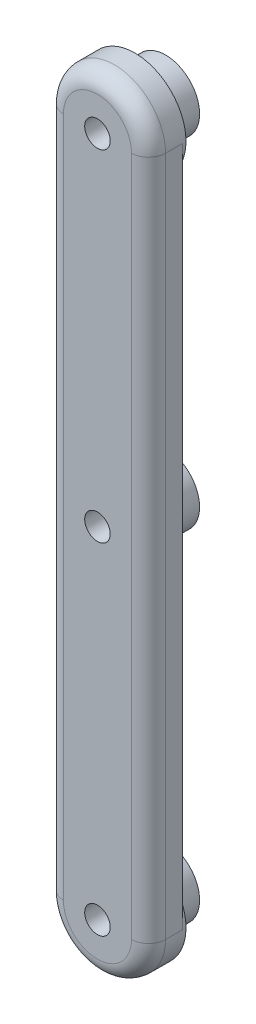
from build123d import *

# Parameters (mm, degrees)
EXTRUDE_1_DEPTH     = 2
SKETCH_3_R          = 4
SKETCH_3_R_2        = 1.5
EXTRUDE_2_DEPTH     = 4
SKETCH_3_3_R        = 6
SKETCH_3_3_R_2      = 4
EXTRUDE_3_DEPTH     = 0.4
FILLET_1_R          = 2
SKETCH_3_4_R        = 1.5
CUT_EXTRUDE_1_DEPTH = 5


with BuildPart() as part:
    # 草图2 → 凸台-拉伸1 (new, symmetric)
    with BuildSketch(Plane.XY):
        with BuildLine():
            Line((6, 40), (6, -40))
            ThreePointArc((6, -40), (0, -46), (-6, -40))
            Line((-6, -40), (-6, 40))
            ThreePointArc((-6, 40), (0, 46), (6, 40))
        make_face()
    extrude(amount=EXTRUDE_1_DEPTH, both=True)

    # 草图3 → 凸台-拉伸2 (add)
    # profile 1 of 3: a face of its own
    with BuildSketch(Plane(origin=(0, 0, -2), x_dir=(-1, 0, 0), z_dir=(0, 0, -1))):
        with Locations((0, -40)):
            Circle(SKETCH_3_R)
        with Locations((0, -40)):
            Circle(SKETCH_3_R_2, mode=Mode.SUBTRACT)
    # profile 2 of 3: a face of its own
    with BuildSketch(Plane(origin=(0, 0, -2), x_dir=(-1, 0, 0), z_dir=(0, 0, -1))):
        with Locations((0, 40)):
            Circle(SKETCH_3_R)
        with Locations((0, 40)):
            Circle(SKETCH_3_R_2, mode=Mode.SUBTRACT)
    # profile 3 of 3: a face of its own
    with BuildSketch(Plane(origin=(0, 0, -2), x_dir=(-1, 0, 0), z_dir=(0, 0, -1))):
        Circle(SKETCH_3_R)
        Circle(SKETCH_3_R_2, mode=Mode.SUBTRACT)
    extrude(amount=EXTRUDE_2_DEPTH)

    # 草图3<3> → 凸台-拉伸3 (add)
    # profile 1 of 2: a face of its own
    with BuildSketch(Plane(origin=(0, 0, -2), x_dir=(-1, 0, 0), z_dir=(0, 0, -1))):
        with Locations((0, 40)):
            Circle(SKETCH_3_3_R)
        with Locations((0, 40)):
            Circle(SKETCH_3_3_R_2, mode=Mode.SUBTRACT)
    # profile 2 of 2: a face of its own
    with BuildSketch(Plane(origin=(0, 0, -2), x_dir=(-1, 0, 0), z_dir=(0, 0, -1))):
        with Locations((0, -40)):
            Circle(SKETCH_3_3_R)
        with Locations((0, -40)):
            Circle(SKETCH_3_3_R_2, mode=Mode.SUBTRACT)
    extrude(amount=EXTRUDE_3_DEPTH)

    # 圆角1
    fillet_1_edges = [part.edges().sort_by_distance(p)[0] for p in [
        (6, 0, 2),
        (0, -46, 2),
        (-6, 0, 2),
        (0, 46, 2),
    ]]
    fillet(fillet_1_edges, radius=FILLET_1_R)

    # 草图3<4> → 切除-拉伸1 (cut, symmetric)
    with BuildSketch(Plane(origin=(0, 0, -2), x_dir=(-1, 0, 0), z_dir=(0, 0, -1))):
        with Locations((0, -40)):
            Circle(SKETCH_3_4_R)
        with Locations((0, 40)):
            Circle(SKETCH_3_4_R)
        Circle(SKETCH_3_4_R)
    extrude(amount=CUT_EXTRUDE_1_DEPTH, both=True, mode=Mode.SUBTRACT)


solid = part.part
